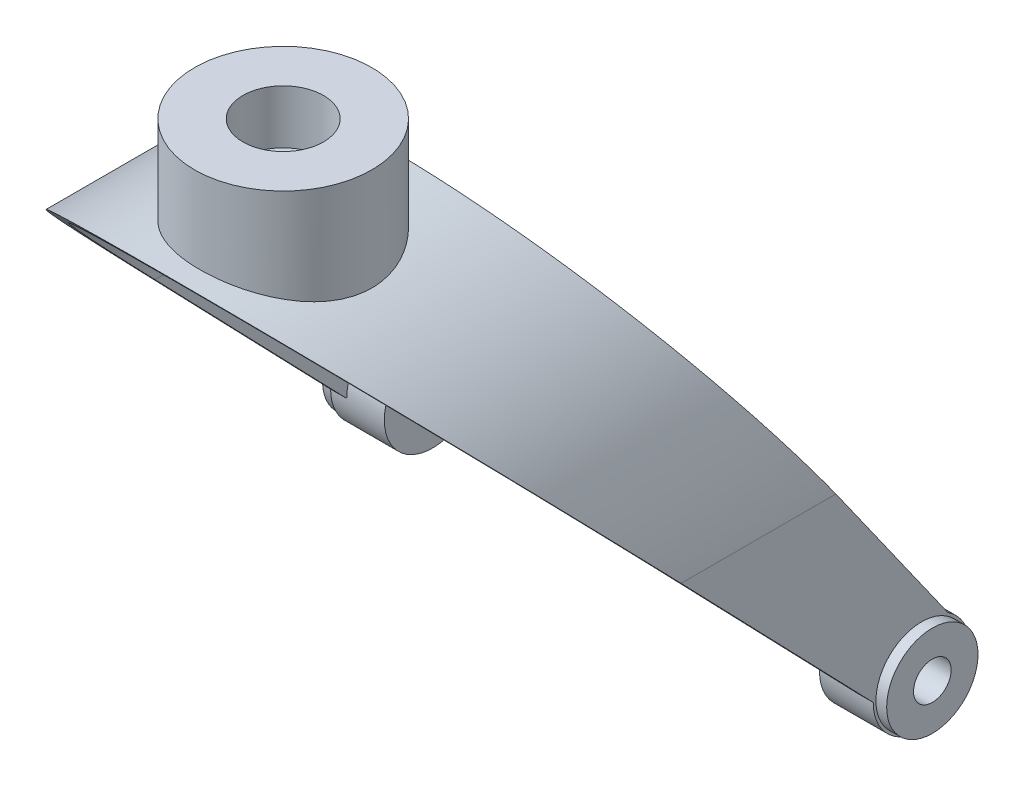
from build123d import *

# Parameters (mm, degrees)
SALIENTE_EXTRUIR1_DEPTH = 100
CORTAR_EXTRUIR1_DEPTH   = 141
CROQUIS3_R              = 9
SALIENTE_EXTRUIR2_DEPTH = 10
CROQUIS4_R              = 8.5
SALIENTE_EXTRUIR3_DEPTH = 2
CROQUIS5_R              = 3.5
CORTAR_EXTRUIR2_DEPTH   = 14
SALIENTE_EXTRUIR5_DEPTH = 1
SALIENTE_EXTRUIR7_REACH = 157.144
CROQUIS11_R             = 16.5
SALIENTE_EXTRUIR8_START = 15
CROQUIS12_R             = 16.5
SALIENTE_EXTRUIR8_DEPTH = 15
CROQUIS13_R             = 7.5
CORTAR_EXTRUIR5_DEPTH   = 10
CORTAR_EXTRUIR6_START   = 24.949967
CORTAR_EXTRUIR6_DEPTH   = 35.050033
SALIENTE_EXTRUIR9_REACH = 151.051
CROQUIS17_W             = 3
CROQUIS17_H             = 1


with BuildPart() as part:
    # Croquis1 → Saliente-Extruir1 (new body)
    with BuildSketch(Plane.XY):
        with BuildLine():
            Line((69.641072198, 46.543110775), (69.641072198, -23.536729858))
            Line((69.641072198, -23.536729858), (66.641072198, -23.536729858))
            Line((66.641072198, -23.536729858), (66.641072198, 46.463270142))
            ThreePointArc((66.641072198, 46.463270142), (19.141072198, 91.463270142), (-28.358927802, 46.463270142))
            Line((-28.358927802, 46.463270142), (-28.358927802, -23.536729858))
            Line((-28.358927802, -23.536729858), (-31.358927802, -23.536729858))
            Line((-31.358927802, -23.536729858), (-31.358927802, 46.543110775))
            ThreePointArc((-31.358927802, 46.543110775), (19.141072198, 94.463270142), (69.641072198, 46.543110775))
        make_face()
    extrude(amount=SALIENTE_EXTRUIR1_DEPTH)

    # Croquis2 → Cortar-Extruir1 (cut)
    with BuildSketch(Plane(origin=(69.641072198, 0, 0), x_dir=(0, 0, -1), z_dir=(1, 0, 0))):
        Polygon((-100, 94.463270142), (-18, 9.463270142), (0, 9.463270142), (-60, 94.463270142), (0, 94.463270142), (15.172467856, 86.125033525), (0, 6.963270142), (0, -23.536729858), (-100, -23.536729858), align=None)
    extrude(amount=-CORTAR_EXTRUIR1_DEPTH, mode=Mode.SUBTRACT)

    # Croquis3 → Saliente-Extruir2 (add)
    with BuildSketch(Plane(origin=(69.641072198, 0, 0), x_dir=(0, 0, -1), z_dir=(1, 0, 0))):
        with Locations(Location((-9, 9.463270142, 0), (0, 0, 90))):
            Circle(CROQUIS3_R)
    saliente_extruir2 = extrude(amount=-SALIENTE_EXTRUIR2_DEPTH)

    # Croquis4 → Saliente-Extruir3 (add)
    with BuildSketch(Plane(origin=(69.641072198, 0, 0), x_dir=(0, 0, -1), z_dir=(1, 0, 0))):
        with Locations(Location((-9, 9.463270142, 0), (0, 0, 270))):
            Circle(CROQUIS4_R)
    saliente_extruir3 = extrude(amount=SALIENTE_EXTRUIR3_DEPTH)

    # Croquis5 → Cortar-Extruir2 (cut)
    with BuildSketch(Plane(origin=(71.641072198, 0, 0), x_dir=(0, 0, -1), z_dir=(1, 0, 0))):
        with Locations(Location((-9, 9.463270142, 0), (0, 0, 90))):
            Circle(CROQUIS5_R)
    cortar_extruir2 = extrude(amount=-CORTAR_EXTRUIR2_DEPTH, mode=Mode.SUBTRACT)

    # Simetría1: Saliente-Extruir2, Saliente-Extruir3, Cortar-Extruir2 across plane
    add(saliente_extruir2.mirror(Plane(origin=(19.141072198, 0, 0), x_dir=(0, 0, 1), z_dir=(1, 0, 0))))
    add(saliente_extruir3.mirror(Plane(origin=(19.141072198, 0, 0), x_dir=(0, 0, 1), z_dir=(1, 0, 0))))
    add(cortar_extruir2.mirror(Plane(origin=(19.141072198, 0, 0), x_dir=(0, 0, 1), z_dir=(1, 0, 0))), mode=Mode.SUBTRACT)

    # Croquis6 → Saliente-Extruir5 (add, symmetric)
    with BuildSketch(Plane(origin=(0, 3.147138338, -4.458445979), x_dir=(-1, 0, 0), z_dir=(0, 0.5766831975986554, -0.8169678632647617))):
        with BuildLine():
            Line((-67.534417906, 18.111485144), (-66.641072198, 18.111485144))
            Line((-66.641072198, 18.111485144), (-66.641072198, 53.020606748))
            add(Edge.make_bspline(
                [(-19.141072198, 108.102332754), (-64.206861672, 108.102332754), (-66.641072198, 53.020606748)],
                knots=[3.141592654, 3.141592654, 3.141592654, 4.658348082, 4.658348082, 4.658348082], degree=2, weights=[1, 0.725952684, 1]))
            Line((-19.141072198, 108.102332754), (-19.141072198, 111.774447821))
            add(Edge.make_bspline(
                [(-19.141072198, 111.774447821), (-67.127128374, 111.774447821), (-69.641072198, 53.118334745)],
                knots=[3.141592654, 3.141592654, 3.141592654, 4.659975938, 4.659975938, 4.659975938], degree=2, weights=[1, 0.725392669, 1]))
            Line((-69.641072198, 53.118334745), (-69.641072198, 18.111485144))
            Line((-69.641072198, 18.111485144), (-67.534417906, 18.111485144))
        make_face()
        with BuildLine():
            Line((-19.141072198, 111.774447821), (-19.141072198, 108.102332754))
            add(Edge.make_bspline(
                [(28.358927802, 53.020606748), (25.924717276, 108.102332754), (-19.141072198, 108.102332754)],
                knots=[1.624837225, 1.624837225, 1.624837225, 3.141592654, 3.141592654, 3.141592654], degree=2, weights=[1, 0.725952684, 1]))
            Line((28.358927802, 53.020606748), (28.358927802, 18.111485144))
            Line((28.358927802, 18.111485144), (31.358927802, 18.111485144))
            Line((31.358927802, 18.111485144), (31.358927802, 53.118334745))
            add(Edge.make_bspline(
                [(31.358927802, 53.118334745), (28.844983978, 111.774447821), (-19.141072198, 111.774447821)],
                knots=[1.62320937, 1.62320937, 1.62320937, 3.141592654, 3.141592654, 3.141592654], degree=2, weights=[1, 0.725392669, 1]))
        make_face()
        with BuildLine():
            add(Edge.make_bspline(
                [(-19.141072198, 108.102332754), (-64.206861672, 108.102332754), (-66.641072198, 53.020606748)],
                knots=[3.141592654, 3.141592654, 3.141592654, 4.658348082, 4.658348082, 4.658348082], degree=2, weights=[1, 0.725952684, 1]))
            ThreePointArc((-66.641072198, 53.020606748), (-46.903607099, 74.026047186), (-19.141072198, 81.774447821))
            Line((-19.141072198, 81.774447821), (-19.141072198, 108.102332754))
        make_face()
        with BuildLine():
            Line((-19.141072198, 108.102332754), (-19.141072198, 81.774447821))
            ThreePointArc((-19.141072198, 81.774447821), (8.621462703, 74.026047186), (28.358927802, 53.020606748))
            add(Edge.make_bspline(
                [(28.358927802, 53.020606748), (25.924717276, 108.102332754), (-19.141072198, 108.102332754)],
                knots=[1.624837225, 1.624837225, 1.624837225, 3.141592654, 3.141592654, 3.141592654], degree=2, weights=[1, 0.725952684, 1]))
        make_face()
    extrude(amount=SALIENTE_EXTRUIR5_DEPTH, both=True)

    # Croquis11 → Saliente-Extruir7 (add, up to next)
    with BuildSketch(Plane(origin=(0, 95, 0), x_dir=(1, 0, 0), z_dir=(0, 1, 0)), mode=Mode.PRIVATE) as saliente_extruir7_sk1:
        with Locations(Location((21.175045512, -79.353799607, 0), (0, 0, 270))):
            Circle(CROQUIS11_R)
    saliente_extruir7_tool1 = extrude(saliente_extruir7_sk1.sketch, amount=-SALIENTE_EXTRUIR7_REACH, mode=Mode.PRIVATE) - part.part
    add(saliente_extruir7_tool1.solids().sort_by_distance((21.175046, 95, 79.3538))[0])

    # Croquis12 → Saliente-Extruir8 (add)
    with BuildSketch(Plane(origin=(0, 95, 0), x_dir=(1, 0, 0), z_dir=(0, 1, 0)).offset(SALIENTE_EXTRUIR8_START)):
        with Locations(Location((21.175045512, -79.353799607, 0), (0, 0, 270))):
            Circle(CROQUIS12_R)
    extrude(amount=-SALIENTE_EXTRUIR8_DEPTH)

    # Croquis13 → Cortar-Extruir5 (cut)
    with BuildSketch(Plane(origin=(0, 110, 0), x_dir=(1, 0, 0), z_dir=(0, 1, 0))):
        with Locations(Location((21.175045512, -79.353799607, 0), (0, 0, 270))):
            Circle(CROQUIS13_R)
    extrude(amount=-CORTAR_EXTRUIR5_DEPTH, mode=Mode.SUBTRACT)

    # Croquis8 → Cortar-Extruir6 (cut)
    with BuildSketch(Plane.XY.offset(CORTAR_EXTRUIR6_START)):
        with BuildLine():
            Line((-31.358927802, 46.543110775), (-43.995227874, 50.405646303))
            Line((-43.995227874, 50.405646303), (-32.93588468, 104.800400399))
            Line((-32.93588468, 104.800400399), (86.326861303, 97.464379117))
            Line((86.326861303, 97.464379117), (84.859657046, 44.645025888))
            Line((84.859657046, 44.645025888), (69.641072198, 46.543110775))
            ThreePointArc((69.641072198, 46.543110775), (19.141072198, 94.463270142), (-31.358927802, 46.543110775))
        make_face()
    extrude(amount=CORTAR_EXTRUIR6_DEPTH, mode=Mode.SUBTRACT)

    # Croquis17 → Saliente-Extruir9 (add, up to next)
    with BuildSketch(Plane(origin=(0, 14.796501319, 10.444589166), x_dir=(1, 0, 0), z_dir=(0, -0.8169678632647617, -0.5766831975986554)), mode=Mode.PRIVATE) as saliente_extruir9_sk1:
        with Locations((-29.858927802, -5.957308885)):
            Rectangle(CROQUIS17_W, CROQUIS17_H)
    saliente_extruir9_tool1 = extrude(saliente_extruir9_sk1.sketch, amount=SALIENTE_EXTRUIR9_REACH, mode=Mode.PRIVATE) - part.part
    saliente_extruir9 = saliente_extruir9_tool1.solids().sort_by_distance((-29.858928, 18.231981, 5.577659))[0]
    add(saliente_extruir9)

    # Simetría2: Saliente-Extruir9 across plane
    add(saliente_extruir9.mirror(Plane(origin=(19.141072198, 0, 0), x_dir=(0, 0, 1), z_dir=(1, 0, 0))))


solid = part.part
